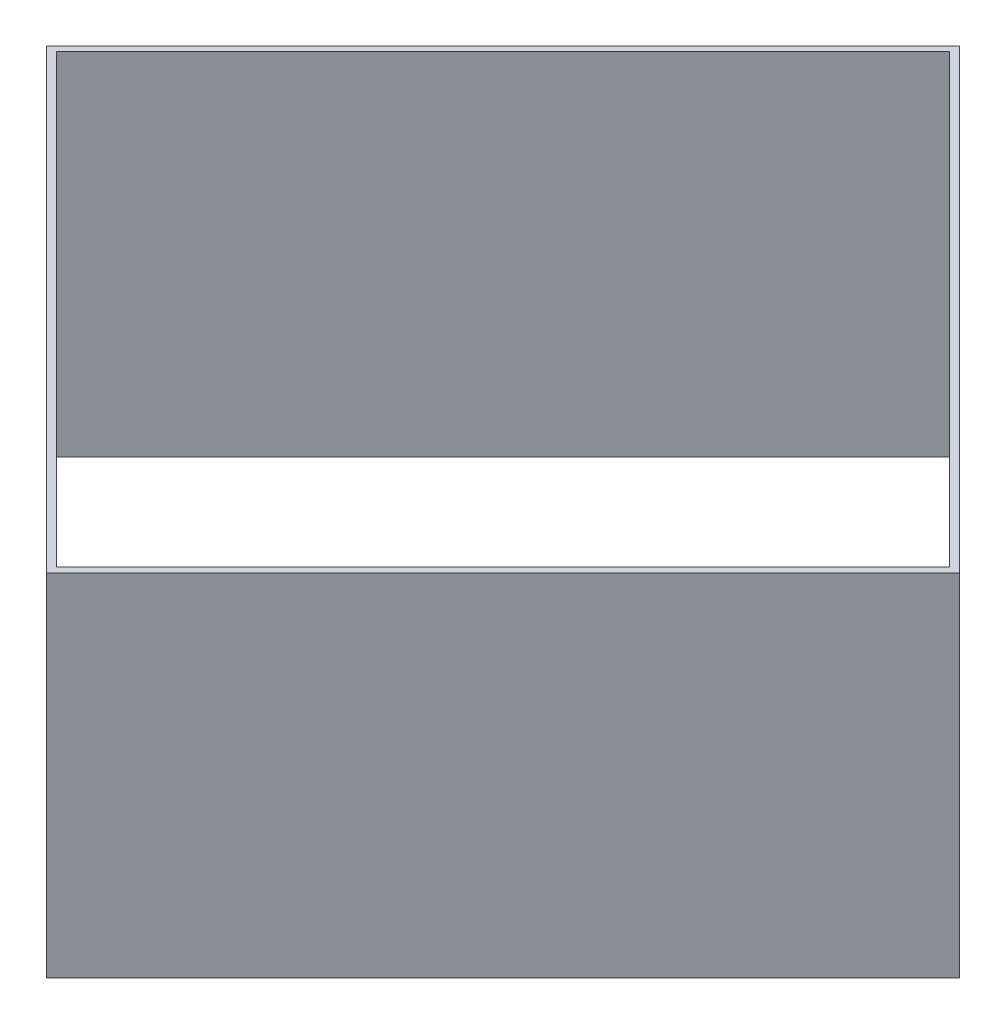
from build123d import *

# Parameters (mm, degrees)
EXTRUDE_1_DEPTH = 10


with BuildPart() as part:
    # Эскиз1 → Вытянуть-Тонкостенный1 (new body)
    with BuildSketch(Plane(origin=(0, 0, 0), x_dir=(1, 0, 0), z_dir=(0, 1, 0))):
        Polygon((13.010764774, 0), (0, -13.010764774), (-13.010764774, 0), (0, 13.010764774), align=None)
        Polygon((12.727922061, 0), (0, -12.727922061), (-12.727922061, 0), (0, 12.727922061), align=None, mode=Mode.SUBTRACT)
    extrude(amount=EXTRUDE_1_DEPTH)


solid = part.part
